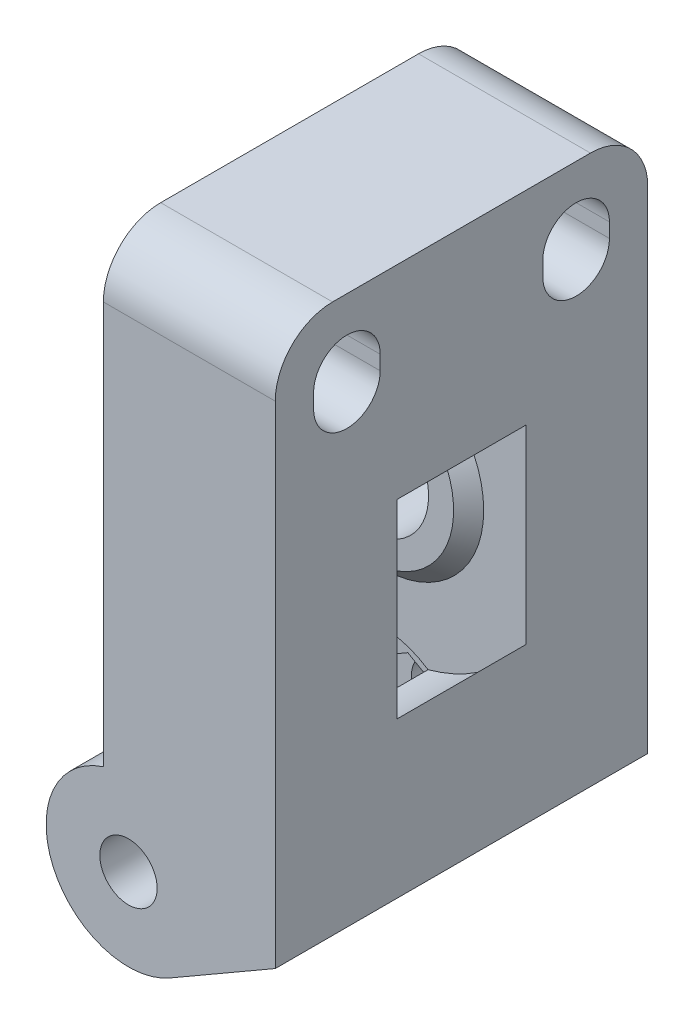
from build123d import *

# Parameters (mm, degrees)
BOSS_EXTRUDE1_DEPTH      = 13
BOSS_EXTRUDE1_DEPTH_BACK = 13
CUT_EXTRUDE1_DEPTH       = 6.5
CUT_EXTRUDE1_DEPTH_BACK  = 6.5
CUT_EXTRUDE3_DEPTH       = 4.5
CUT_EXTRUDE3_DEPTH_BACK  = 4.5
SKETCH3_R                = 12
CUT_EXTRUDE4_DEPTH       = 10
CUT_EXTRUDE4_DEPTH_BACK  = 10
SKETCH4_R                = 4.25
SKETCH5_R                = 2
CUT_EXTRUDE5_DEPTH       = 47.828649116
SKETCH9_W                = 5.05
SKETCH9_H                = 13.520724833
CUT_EXTRUDE8_DEPTH       = 43.698622671
CUT_EXTRUDE9_DEPTH       = 42.532474067
FILLET1_R                = 4
CUT_EXTRUDE10_DEPTH      = 2.25


with BuildPart() as part:
    # Sketch1 → Boss-Extrude1 (new, two sides: drawn at the far end of the back side and taken through both)
    with BuildSketch(Plane.XY.offset(-BOSS_EXTRUDE1_DEPTH_BACK)):
        with BuildLine():
            Line((-1.754221061, 5.475875133), (-1.754221061, 37.575875133))
            Line((-1.754221061, 37.575875133), (10.245778939, 37.575875133))
            Line((10.245778939, 37.575875133), (10.245778939, -0.724124867))
            Line((10.245778939, -0.724124867), (2.875, -4.979646072))
            ThreePointArc((2.875, -4.979646072), (-5.257710269, -2.327870857), (-1.754221061, 5.475875133))
        make_face()
    extrude(amount=BOSS_EXTRUDE1_DEPTH + BOSS_EXTRUDE1_DEPTH_BACK)

    # Sketch2 → Cut-Extrude1 (cut, two sides: drawn at the far end of the back side and taken through both)
    with BuildSketch(Plane.XY.offset(-CUT_EXTRUDE1_DEPTH_BACK)):
        with BuildLine():
            Line((8.244357503, -1.879646072), (5.369357503, 3.1))
            ThreePointArc((5.369357503, 3.1), (2.300687806, 5.757328862), (-1.754221061, 5.946655234))
            Line((-1.754221061, 5.946655234), (-5.75, 5.946655234))
            Line((-5.75, 5.946655234), (-5.75, -5.75))
            Line((-5.75, -5.75), (8.244357503, -5.75))
            Line((8.244357503, -5.75), (8.244357503, -1.879646072))
        make_face()
    extrude(amount=CUT_EXTRUDE1_DEPTH + CUT_EXTRUDE1_DEPTH_BACK, mode=Mode.SUBTRACT)

    # Sketch3 → Cut-Extrude3 (cut, two sides: drawn at the far end of the back side and taken through both)
    with BuildSketch(Plane.XY.offset(-CUT_EXTRUDE3_DEPTH_BACK)):
        with Locations((0.245778939, 16.750875133)):
            Circle(SKETCH3_R)
    extrude(amount=CUT_EXTRUDE3_DEPTH + CUT_EXTRUDE3_DEPTH_BACK, mode=Mode.SUBTRACT)

    # Sketch4 → Cut-Extrude4 (cut, two sides: drawn at the far end of the back side and taken through both)
    with BuildSketch(Plane.XY.offset(-CUT_EXTRUDE4_DEPTH_BACK)):
        with Locations((0.245778939, 16.750875133)):
            Circle(SKETCH4_R)
    extrude(amount=CUT_EXTRUDE4_DEPTH + CUT_EXTRUDE4_DEPTH_BACK, mode=Mode.SUBTRACT)

    # Sketch5 → Cut-Extrude5 (cut, through all)
    with BuildSketch(Plane.XY.offset(13)):
        Circle(SKETCH5_R)
    extrude(amount=-CUT_EXTRUDE5_DEPTH, mode=Mode.SUBTRACT)

    # Sweep4: sweep along a path in Sketch8
    with BuildLine(Plane(origin=(0, 0, 4.5), x_dir=(-1, 0, 0), z_dir=(0, 0, -1))) as sweep4_path:
        CenterArc((-0.245778939, 16.750875133), 4.25, 0, 360)
    # 3DSketch3 → Sweep4 (sweep)
    with BuildSketch(Plane(origin=(4.495778939, 16.750875133, 4.5), x_dir=(1, 0, 0), z_dir=(0, 1, 0))):
        Polygon((0, 0), (2.8, 0), (1.75, 1.05), (0, 1.05), align=None)
    sweep4 = sweep(path=sweep4_path.line)

    # Mirror10: Sweep4 across plane
    add(sweep4.mirror(Plane.XY))

    # Sketch9 → Cut-Extrude8 (cut, through all)
    with BuildSketch(Plane(origin=(0, 0, 4.5), x_dir=(-1, 0, 0), z_dir=(0, 0, -1))):
        with Locations((4.279221061, 16.750875132)):
            Rectangle(SKETCH9_W, SKETCH9_H)
    extrude(amount=CUT_EXTRUDE8_DEPTH, mode=Mode.SUBTRACT)

    # Sketch10 → Cut-Extrude9 (cut, through all)
    with BuildSketch(Plane.ZY.offset(1.754221061)):
        with BuildLine():
            Line((-5.675, 32.750875133), (-5.675, 31.750875133))
            ThreePointArc((-5.675, 31.750875133), (-8, 29.425875133), (-10.325, 31.750875133))
            Line((-10.325, 31.750875133), (-10.325, 32.750875133))
            ThreePointArc((-10.325, 32.750875133), (-8, 35.075875133), (-5.675, 32.750875133))
        make_face()
        with BuildLine():
            Line((5.675, 32.750875133), (5.675, 31.750875133))
            ThreePointArc((5.675, 31.750875133), (8, 29.425875133), (10.325, 31.750875133))
            Line((10.325, 31.750875133), (10.325, 32.750875133))
            ThreePointArc((10.325, 32.750875133), (8, 35.075875133), (5.675, 32.750875133))
        make_face()
    extrude(amount=-CUT_EXTRUDE9_DEPTH, mode=Mode.SUBTRACT)

    # Fillet1
    fillet1_edges = [part.edges().sort_by_distance(p)[0] for p in [
        (4.245778939, 37.575875133, 13),
        (4.245778939, 37.575875133, -13),
    ]]
    fillet(fillet1_edges, radius=FILLET1_R)

    # Sketch11 → Cut-Extrude10 (cut)
    with BuildSketch(Plane.XY.offset(-6.5)):
        Polygon((0, 3.5), (-3.031088913, 1.75), (-3.031088913, -1.75), (0, -3.5), (3.031088913, -1.75), (3.031088913, 1.75), align=None)
    extrude(amount=-CUT_EXTRUDE10_DEPTH, mode=Mode.SUBTRACT)


solid = part.part
